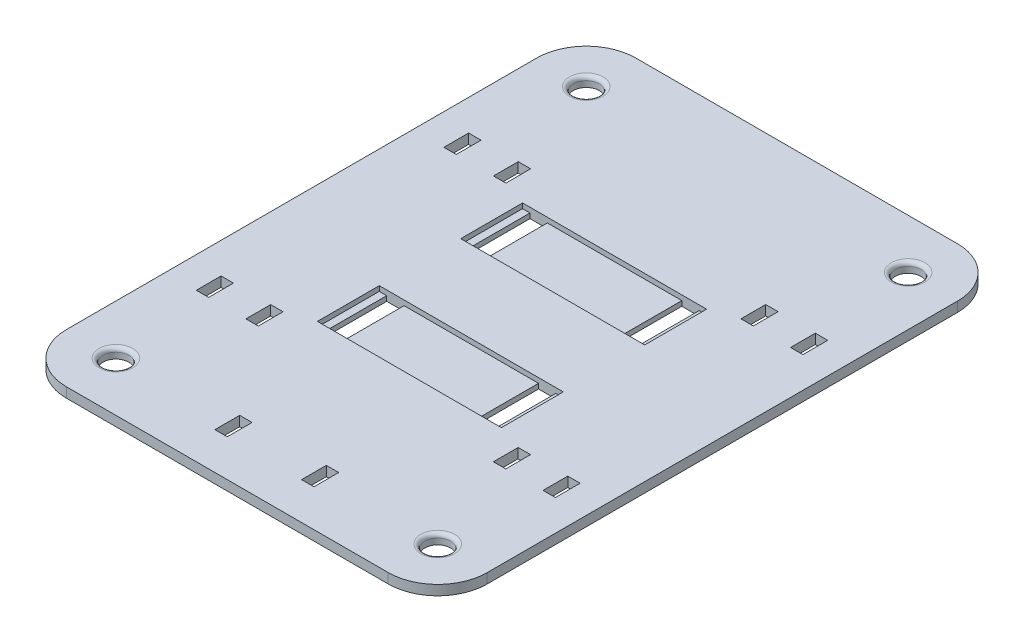
from build123d import *

# Parameters (mm, degrees)
SKETCH1_W           = 107.95
SKETCH1_H           = 146.05
BOSS_EXTRUDE1_DEPTH = 2.54
SKETCH2_R           = 3.302
CUT_EXTRUDE1_DEPTH  = 91.842736914
SKETCH3_W           = 4.445
SKETCH3_H           = 15.875
CUT_EXTRUDE2_DEPTH  = 91.842736914
FILLET1_R           = 12.7
SKETCH11_W          = 47.200058
SKETCH11_H          = 15.875
CUT_EXTRUDE9_DEPTH  = 1.27
FILLET2_R           = 1.016
SKETCH14_W          = 3.175
SKETCH14_H          = 6.35
CUT_EXTRUDE14_DEPTH = 91.842736914


with BuildPart() as part:
    # Sketch1 → Boss-Extrude1 (new body)
    with BuildSketch(Plane(origin=(0, 0, 0), x_dir=(1, 0, 0), z_dir=(0, 1, 0))):
        Rectangle(SKETCH1_W, SKETCH1_H)
    extrude(amount=-BOSS_EXTRUDE1_DEPTH)

    # Sketch2 → Cut-Extrude1 (cut, through all)
    with BuildSketch(Plane(origin=(0, 0, 0), x_dir=(1, 0, 0), z_dir=(0, 1, 0))):
        with Locations((-41.275, 60.325)):
            Circle(SKETCH2_R)
        with Locations((41.275, 60.325)):
            Circle(SKETCH2_R)
        with Locations((41.275, -60.325)):
            Circle(SKETCH2_R)
        with Locations((-41.275, -60.325)):
            Circle(SKETCH2_R)
    extrude(amount=-CUT_EXTRUDE1_DEPTH, mode=Mode.SUBTRACT)

    # Sketch3 → Cut-Extrude2 (cut, through all)
    with BuildSketch(Plane(origin=(0, 0, 0), x_dir=(1, 0, 0), z_dir=(0, 1, 0))):
        with Locations((-19.472529, 18.374995)):
            Rectangle(SKETCH3_W, SKETCH3_H)
        with Locations((19.472529, 18.374995)):
            Rectangle(SKETCH3_W, SKETCH3_H)
        with Locations((19.472529, -18.374995)):
            Rectangle(SKETCH3_W, SKETCH3_H)
        with Locations((-19.472529, -18.374995)):
            Rectangle(SKETCH3_W, SKETCH3_H)
    extrude(amount=-CUT_EXTRUDE2_DEPTH, mode=Mode.SUBTRACT)

    # Fillet1
    fillet1_edges = [part.edges().sort_by_distance(p)[0] for p in [
        (53.975, -1.27, -73.025),
        (53.975, -1.27, 73.025),
        (-53.975, -1.27, 73.025),
        (-53.975, -1.27, -73.025),
    ]]
    fillet(fillet1_edges, radius=FILLET1_R)

    # Sketch11 → Cut-Extrude9 (cut, symmetric)
    with BuildSketch(Plane(origin=(0, 0, 0), x_dir=(1, 0, 0), z_dir=(0, 1, 0))):
        with Locations((0, -18.374995)):
            Rectangle(SKETCH11_W, SKETCH11_H)
        with Locations((0, 18.374995)):
            Rectangle(SKETCH11_W, SKETCH11_H)
    extrude(amount=CUT_EXTRUDE9_DEPTH, both=True, mode=Mode.SUBTRACT)

    # Fillet2
    fillet2_edges = [part.edges().sort_by_distance(p)[0] for p in [
        (37.973, 0, -60.325),
        (-44.577, 0, -60.325),
        (-44.577, 0, 60.325),
        (37.973, 0, 60.325),
    ]]
    fillet(fillet2_edges, radius=FILLET2_R)

    # Sketch14 → Cut-Extrude14 (cut, through all)
    with BuildSketch(Plane(origin=(0, 0, 0), x_dir=(1, 0, 0), z_dir=(0, 1, 0))):
        with Locations((31.7373, -31.75)):
            Rectangle(SKETCH14_W, SKETCH14_H)
        with Locations((-31.7373, -31.75)):
            Rectangle(SKETCH14_W, SKETCH14_H)
        with Locations((-31.7373, 31.75)):
            Rectangle(SKETCH14_W, SKETCH14_H)
        with Locations((31.7373, 31.75)):
            Rectangle(SKETCH14_W, SKETCH14_H)
        with Locations((-11.1125, -60.325)):
            Rectangle(SKETCH14_W, SKETCH14_H)
        with Locations((11.1125, -60.325)):
            Rectangle(SKETCH14_W, SKETCH14_H)
        with Locations((44.4627, 31.75)):
            Rectangle(SKETCH14_W, SKETCH14_H)
        with Locations((44.4627, -31.75)):
            Rectangle(SKETCH14_W, SKETCH14_H)
        with Locations((-44.4627, 31.75)):
            Rectangle(SKETCH14_W, SKETCH14_H)
        with Locations((-44.4627, -31.75)):
            Rectangle(SKETCH14_W, SKETCH14_H)
    extrude(amount=-CUT_EXTRUDE14_DEPTH, mode=Mode.SUBTRACT)


solid = part.part
